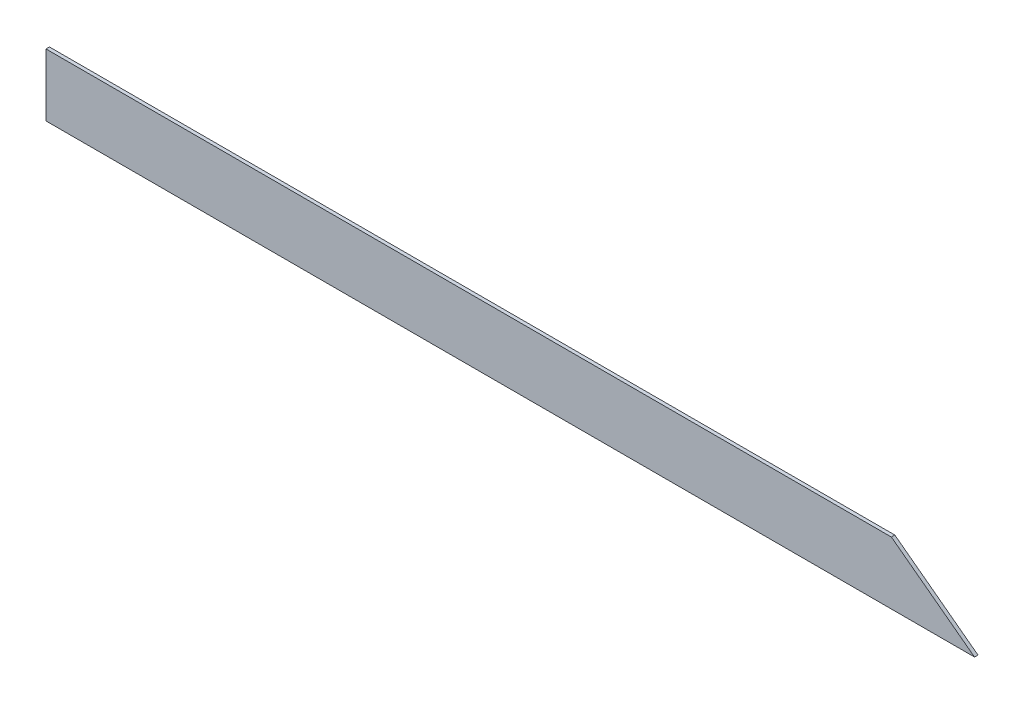
from build123d import *

# Parameters (mm, degrees)
BOSS_EXTRUDE1_DEPTH = 1.5875


with BuildPart() as part:
    # Sketch2 → Boss-Extrude1 (new body)
    with BuildSketch(Plane.XY):
        Polygon((0, 0), (425.45, 0), (387.35, 28.575), (0, 28.575), align=None)
    extrude(amount=BOSS_EXTRUDE1_DEPTH)


solid = part.part
